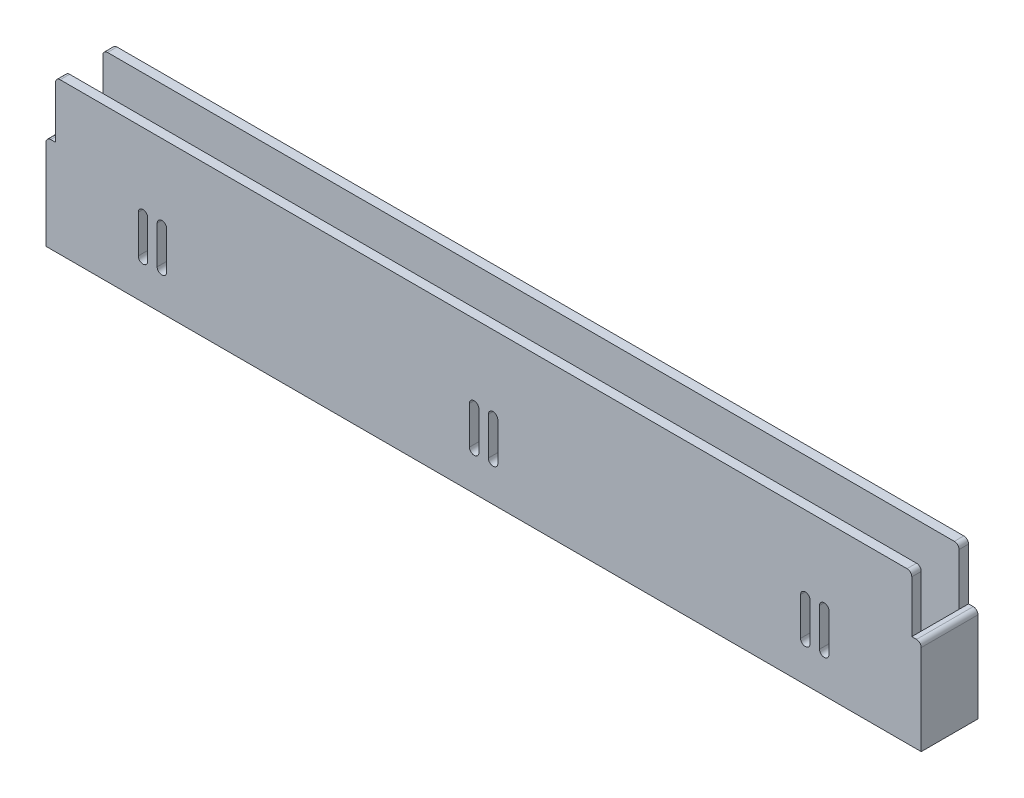
from build123d import *

# Parameters (mm, degrees)
SKETCH_1_W          = 181
SKETCH_1_H          = 30
EXTRUDE_1_DEPTH     = 2
SKETCH_2_W          = 181
SKETCH_2_H          = 2
EXTRUDE_2_DEPTH     = 10
SKETCH_3_W          = 181
SKETCH_3_H          = 32
EXTRUDE_3_DEPTH     = 2
CUT_EXTRUDE_1_DEPTH = 2
SKETCH_5_W          = 12
SKETCH_5_H          = 20.057389113
EXTRUDE_4_DEPTH     = 2
SKETCH_6_W          = 12
SKETCH_6_H          = 20.057389113
EXTRUDE_5_DEPTH     = 2
FILLET_1_R          = 1


with BuildPart() as part:
    # 草图1 → 凸台-拉伸1 (new body)
    with BuildSketch(Plane.XY):
        with Locations((90.5, 15)):
            Rectangle(SKETCH_1_W, SKETCH_1_H)
    extrude(amount=EXTRUDE_1_DEPTH)

    # 草图2 → 凸台-拉伸2 (add)
    with BuildSketch(Plane.XY):
        with Locations((90.5, -1)):
            Rectangle(SKETCH_2_W, SKETCH_2_H)
    extrude(amount=EXTRUDE_2_DEPTH)

    # 草图3 → 凸台-拉伸3 (add)
    with BuildSketch(Plane.XY.offset(10)):
        with Locations((90.5, 14)):
            Rectangle(SKETCH_3_W, SKETCH_3_H)
    extrude(amount=EXTRUDE_3_DEPTH)

    # 草图4 → 切除-拉伸1 (cut)
    with BuildSketch(Plane.XY.offset(12)):
        with BuildLine():
            Line((19.5, 6), (19.5, 10))
            Line((19.5, 10), (19.5, 14))
            ThreePointArc((19.5, 14), (18.5, 15), (17.5, 14))
            Line((17.5, 14), (17.5, 6))
            ThreePointArc((17.5, 6), (18.5, 5), (19.5, 6))
        make_face()
        with BuildLine():
            Line((21.5, 14), (21.5, 6))
            ThreePointArc((21.5, 6), (22.5, 5), (23.5, 6))
            Line((23.5, 6), (23.5, 14))
            ThreePointArc((23.5, 14), (22.5, 15), (21.5, 14))
        make_face()
        with BuildLine():
            Line((157.5, 14), (157.5, 6))
            ThreePointArc((157.5, 6), (158.5, 5), (159.5, 6))
            Line((159.5, 6), (159.5, 14))
            ThreePointArc((159.5, 14), (158.5, 15), (157.5, 14))
        make_face()
        with BuildLine():
            Line((91.5, 14), (91.5, 6))
            ThreePointArc((91.5, 6), (92.5, 5), (93.5, 6))
            Line((93.5, 6), (93.5, 14))
            ThreePointArc((93.5, 14), (92.5, 15), (91.5, 14))
        make_face()
        with BuildLine():
            Line((87.5, 14), (87.5, 6))
            ThreePointArc((87.5, 6), (88.5, 5), (89.5, 6))
            Line((89.5, 6), (89.5, 14))
            ThreePointArc((89.5, 14), (88.5, 15), (87.5, 14))
        make_face()
        with BuildLine():
            Line((163.5, 6), (163.5, 14))
            ThreePointArc((163.5, 14), (162.5, 15), (161.5, 14))
            Line((161.5, 14), (161.5, 6))
            ThreePointArc((161.5, 6), (162.5, 5), (163.5, 6))
        make_face()
    extrude(amount=-CUT_EXTRUDE_1_DEPTH, mode=Mode.SUBTRACT)

    # 草图5 → 凸台-拉伸4 (add)
    with BuildSketch(Plane(origin=(0, 0, 0), x_dir=(0, 0, -1), z_dir=(1, 0, 0))):
        with Locations((-6, 8.028694557)):
            Rectangle(SKETCH_5_W, SKETCH_5_H)
    extrude(amount=-EXTRUDE_4_DEPTH)

    # 草图6 → 凸台-拉伸5 (add)
    with BuildSketch(Plane(origin=(181, 0, 0), x_dir=(0, 0, -1), z_dir=(1, 0, 0))):
        with Locations((-6, 8.028694557)):
            Rectangle(SKETCH_6_W, SKETCH_6_H)
    extrude(amount=EXTRUDE_5_DEPTH)

    # 圆角1
    fillet_1_edges = [part.edges().sort_by_distance(p)[0] for p in [
        (-2, 18.057389113, 6),
        (183, 18.057389113, 6),
        (181, 30, 11),
        (0, 30, 11),
        (0, 30, 1),
        (181, 30, 1),
    ]]
    fillet(fillet_1_edges, radius=FILLET_1_R)


solid = part.part
